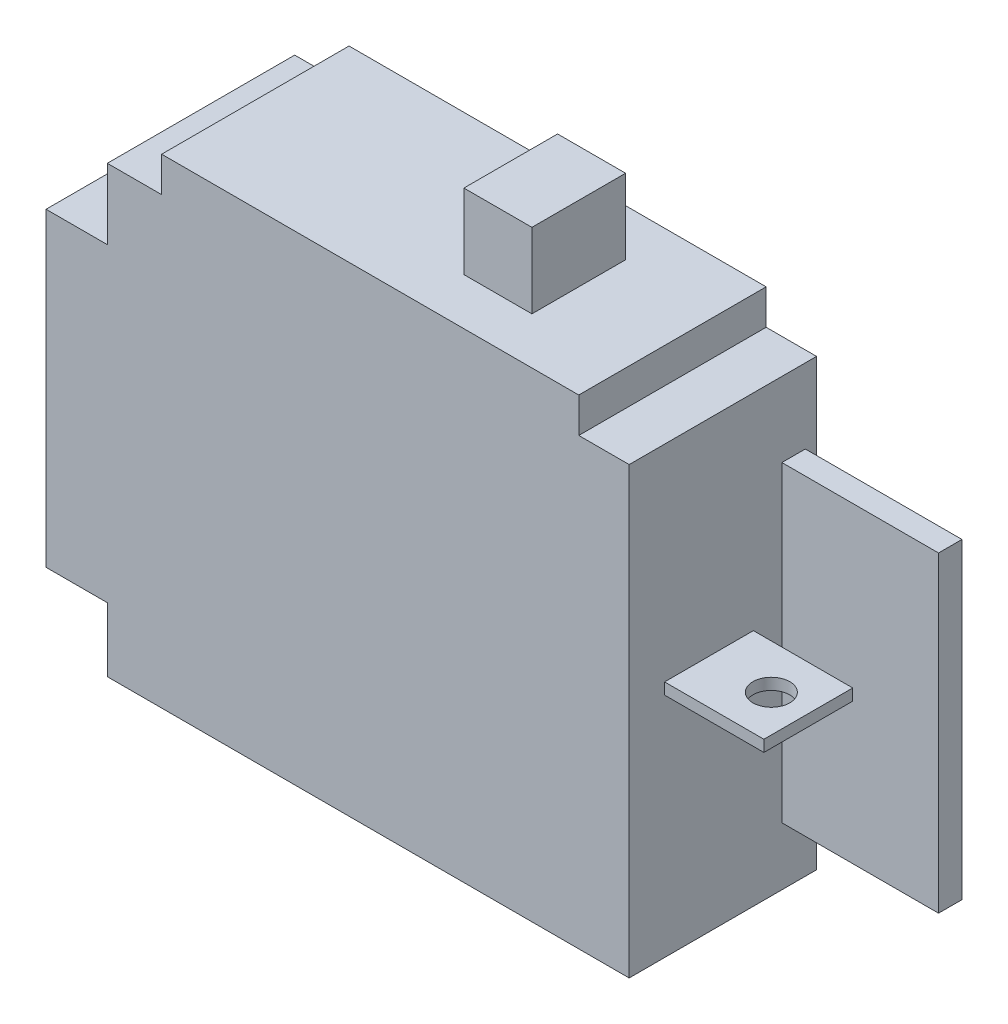
from build123d import *

# Parameters (mm, degrees)
BOSS_EXTRUDE1_DEPTH = 25.4
SKETCH2_W           = 3.175
SKETCH2_H           = 42.291
BOSS_EXTRUDE2_DEPTH = 21.2344
SKETCH3_W           = 12.0396
SKETCH3_H           = 1.5494
BOSS_EXTRUDE3_DEPTH = 13.462
SKETCH4_R           = 2.49555
CUT_EXTRUDE1_DEPTH  = 16.51
SKETCH5_W           = 9.2202
SKETCH5_H           = 10.16
CUT_EXTRUDE2_DEPTH  = 6.35
SKETCH6_W           = 9.2202
SKETCH6_H           = 10.16
CUT_EXTRUDE3_DEPTH  = 6.35


with BuildPart() as part:
    # Sketch1 → Boss-Extrude1 (new body)
    with BuildSketch(Plane.XY):
        Polygon((28.5369, 30.1371), (35.3695, 30.1371), (35.3695, -30.1371), (-35.3695, -30.1371), (-35.3695, -21.4503), (-43.6753, -21.4503), (-43.6753, 20.5867), (-35.3695, 20.5867), (-35.3695, 30.1371), (-28.0035, 30.1371), (-28.0035, 34.8869), (6.6167, 34.8869), (6.6167, 45.0469), (15.8369, 45.0469), (15.8369, 34.8869), (28.5369, 34.8869), align=None)
    extrude(amount=BOSS_EXTRUDE1_DEPTH)

    # Sketch2 → Boss-Extrude2 (add)
    with BuildSketch(Plane(origin=(35.3695, 0, 0), x_dir=(0, 0, -1), z_dir=(1, 0, 0))):
        with Locations((-3.1115, -1.11983587)):
            Rectangle(SKETCH2_W, SKETCH2_H)
    extrude(amount=BOSS_EXTRUDE2_DEPTH)

    # Sketch3 → Boss-Extrude3 (add)
    with BuildSketch(Plane(origin=(35.3695, 0, 0), x_dir=(0, 0, -1), z_dir=(1, 0, 0))):
        with Locations((-14.5796, 1.4478)):
            Rectangle(SKETCH3_W, SKETCH3_H)
    extrude(amount=BOSS_EXTRUDE3_DEPTH)

    # Sketch4 → Cut-Extrude1 (cut)
    with BuildSketch(Plane(origin=(0, 2.2225, 0), x_dir=(1, 0, 0), z_dir=(0, 1, 0))):
        with Locations(Location((43.82135, -14.5796, 0), (0, 0, 270))):
            Circle(SKETCH4_R)
    extrude(amount=-CUT_EXTRUDE1_DEPTH, mode=Mode.SUBTRACT)

    # Sketch5 → Cut-Extrude2 (cut)
    with BuildSketch(Plane.XY.offset(25.4)):
        with Locations((11.2268, 39.9669)):
            Rectangle(SKETCH5_W, SKETCH5_H)
    extrude(amount=-CUT_EXTRUDE2_DEPTH, mode=Mode.SUBTRACT)

    # Sketch6 → Cut-Extrude3 (cut)
    with BuildSketch(Plane(origin=(0, 0, 0), x_dir=(-1, 0, 0), z_dir=(0, 0, -1))):
        with Locations((-11.2268, 39.9669)):
            Rectangle(SKETCH6_W, SKETCH6_H)
    extrude(amount=-CUT_EXTRUDE3_DEPTH, mode=Mode.SUBTRACT)


solid = part.part
